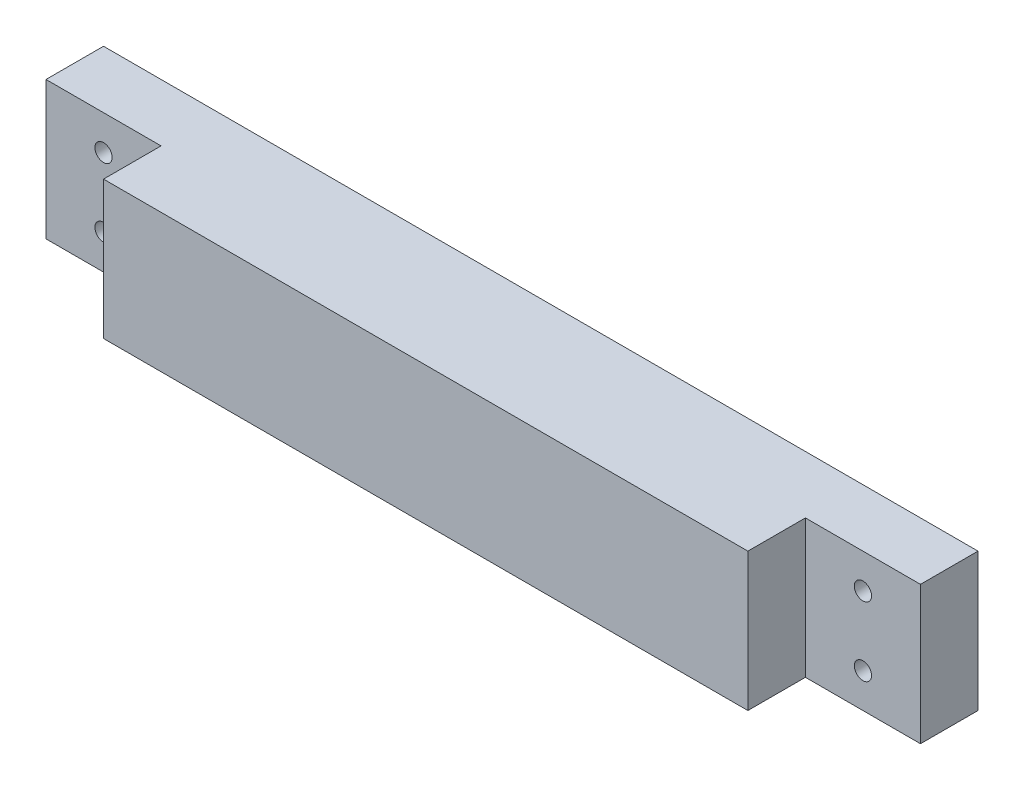
from build123d import *

# Parameters (mm, degrees)
SKETCH1_W           = 482.6
SKETCH1_H           = 76.2
BOSS_EXTRUDE1_DEPTH = 31.75
SKETCH2_W           = 355.6
SKETCH2_H           = 76.2
BOSS_EXTRUDE2_DEPTH = 31.75
SKETCH3_R           = 4.7625
CUT_EXTRUDE1_DEPTH  = 247.343992214


with BuildPart() as part:
    # Sketch1 → Boss-Extrude1 (new body)
    with BuildSketch(Plane.XY):
        Rectangle(SKETCH1_W, SKETCH1_H)
    extrude(amount=BOSS_EXTRUDE1_DEPTH)

    # Sketch2 → Boss-Extrude2 (add)
    with BuildSketch(Plane.XY.offset(31.75)):
        Rectangle(SKETCH2_W, SKETCH2_H)
    extrude(amount=BOSS_EXTRUDE2_DEPTH)

    # Sketch3 → Cut-Extrude1 (cut, through all)
    with BuildSketch(Plane.XY.offset(31.75)):
        with Locations((-209.55, 19.05)):
            Circle(SKETCH3_R)
        with Locations((-209.55, -19.05)):
            Circle(SKETCH3_R)
    cut_extrude1 = extrude(amount=-CUT_EXTRUDE1_DEPTH, mode=Mode.SUBTRACT)

    # Mirror1: Cut-Extrude1 across plane
    add(cut_extrude1.mirror(Plane(origin=(0, 0, 0), x_dir=(0, 0, 1), z_dir=(1, 0, 0))), mode=Mode.SUBTRACT)


solid = part.part
